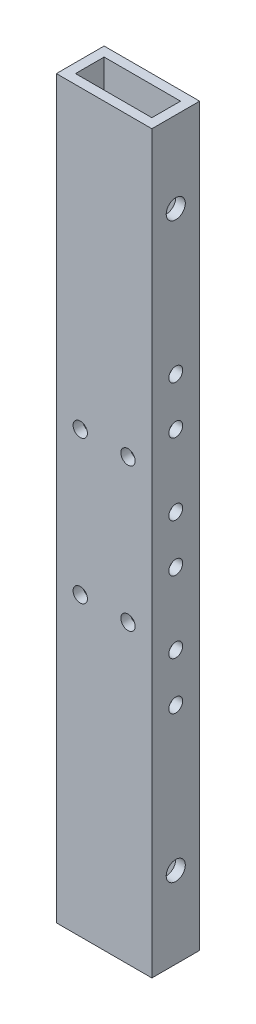
from build123d import *

# Parameters (mm, degrees)
SKETCH_1_W          = 20
SKETCH_1_H          = 10
SKETCH_1_W_2        = 16
SKETCH_1_H_2        = 6
EXTRUDE_1_DEPTH     = 77
SKETCH_2_R          = 1.45
SKETCH_2_R_2        = 2
CUT_EXTRUDE_1_DEPTH = 80.711981534
SKETCH_3_R          = 1.5
CUT_EXTRUDE_2_DEPTH = 79.287930104


with BuildPart() as part:
    # 草图1 → 凸台-拉伸1 (new, symmetric)
    with BuildSketch(Plane(origin=(0, 0, 0), x_dir=(1, 0, 0), z_dir=(0, 1, 0))):
        Rectangle(SKETCH_1_W, SKETCH_1_H)
        Rectangle(SKETCH_1_W_2, SKETCH_1_H_2, mode=Mode.SUBTRACT)
    extrude(amount=EXTRUDE_1_DEPTH, both=True)

    # 草图2 → 切除-拉伸1 (cut, through all)
    with BuildSketch(Plane(origin=(10, 0, 0), x_dir=(0, 0, -1), z_dir=(1, 0, 0))):
        with Locations((0, 5)):
            Circle(SKETCH_2_R)
        with Locations((0, 20)):
            Circle(SKETCH_2_R)
        with Locations((0, 30)):
            Circle(SKETCH_2_R)
        with Locations((0, -30)):
            Circle(SKETCH_2_R)
        with Locations((0, -20)):
            Circle(SKETCH_2_R)
        with Locations((0, -5)):
            Circle(SKETCH_2_R)
        with Locations((0, 60)):
            Circle(SKETCH_2_R_2)
        with Locations((0, -60)):
            Circle(SKETCH_2_R_2)
    extrude(amount=-CUT_EXTRUDE_1_DEPTH, mode=Mode.SUBTRACT)

    # 草图3 → 切除-拉伸2 (cut, through all)
    with BuildSketch(Plane(origin=(0, 0, -5), x_dir=(-1, 0, 0), z_dir=(0, 0, -1))):
        with Locations((5, -15)):
            Circle(SKETCH_3_R)
        with Locations((-5, -15)):
            Circle(SKETCH_3_R)
        with Locations((5, 15)):
            Circle(SKETCH_3_R)
        with Locations((-5, 15)):
            Circle(SKETCH_3_R)
    extrude(amount=-CUT_EXTRUDE_2_DEPTH, mode=Mode.SUBTRACT)


solid = part.part
